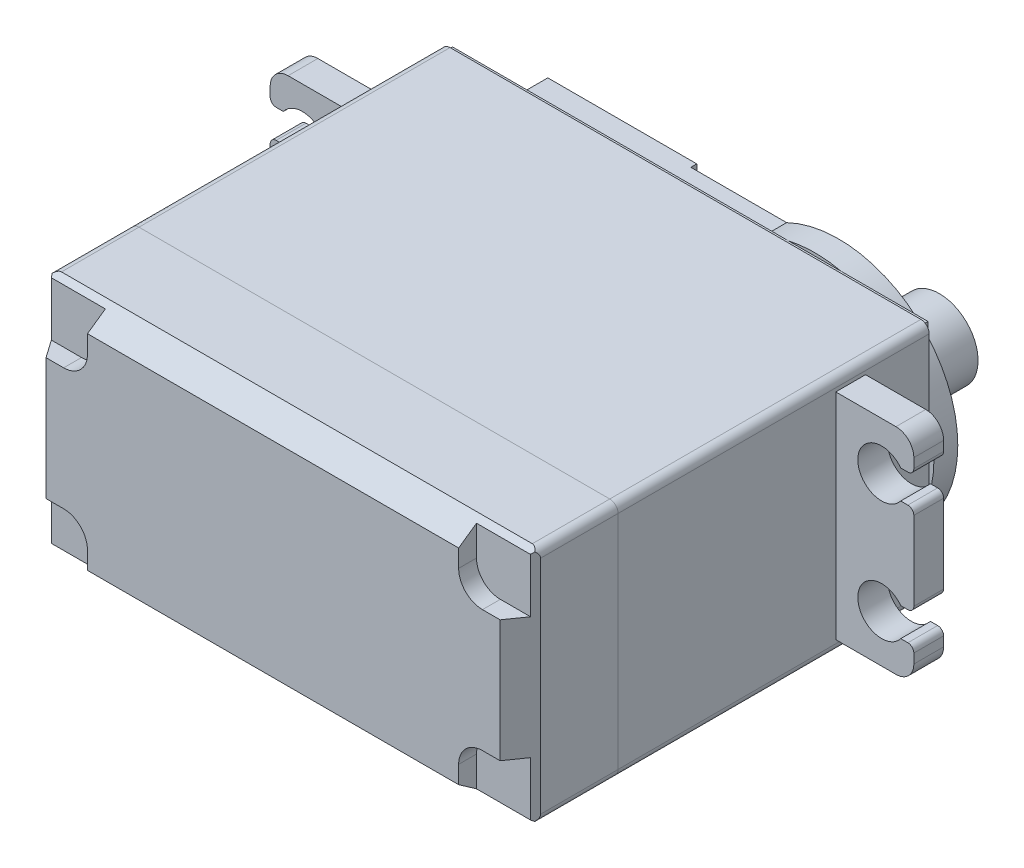
from build123d import *
from OCP.BRepFilletAPI import BRepFilletAPI_MakeChamfer

# Parameters (mm, degrees)
SKETCH1_W            = 40.9
SKETCH1_H            = 20
BOSS_EXTRUDE1_DEPTH  = 19.3
SKETCH2_W            = 40.9
SKETCH2_H            = 20
BOSS_EXTRUDE2_DEPTH  = 6.8
SKETCH3_W            = 40.9
SKETCH3_H            = 20
BOSS_EXTRUDE3_DEPTH  = 8.5
CHAMFER1_SIZE        = 2
CHAMFER1_SIZE2       = 1.400415076
CUT_EXTRUDE1_DEPTH   = 1.5
SKETCH5_W            = 39.9
SKETCH5_H            = 19.5
BOSS_EXTRUDE4_DEPTH  = 0.4
BOSS_EXTRUDE5_DEPTH  = 2
SKETCH8_R            = 6.5
BOSS_EXTRUDE6_DEPTH  = 1.5
SKETCH9_R            = 5.5
BOSS_EXTRUDE7_DEPTH  = 0.5
SKETCH10_R           = 3.25
BOSS_EXTRUDE8_DEPTH  = 5
SKETCH11_W           = 10.5
SKETCH11_H           = 15.998933302
BOSS_EXTRUDE9_DEPTH  = 0.5
FILLET1_R            = 0.7
FILLET2_R            = 0.7
FILLET3_R            = 0.7
BOSS_EXTRUDE10_START = -5.74
BOSS_EXTRUDE10_DEPTH = 2.5


with BuildPart() as part:
    # Sketch1 → Boss-Extrude1 (new body)
    with BuildSketch(Plane.XY):
        Rectangle(SKETCH1_W, SKETCH1_H)
    extrude(amount=BOSS_EXTRUDE1_DEPTH)

    # Fillet1
    fillet1_edges = [part.edges().sort_by_distance(p)[0] for p in [
        (-20.45, 10, 9.65),
        (20.45, 10, 9.65),
        (20.45, -10, 9.65),
        (-20.45, -10, 9.65),
    ]]
    fillet(fillet1_edges, radius=FILLET1_R)



with BuildPart() as body_2:
    # Sketch2 → Boss-Extrude2 (new body)
    with BuildSketch(Plane(origin=(0, 0, 0), x_dir=(-1, 0, 0), z_dir=(0, 0, -1))):
        Rectangle(SKETCH2_W, SKETCH2_H)
    extrude(amount=BOSS_EXTRUDE2_DEPTH)

    # Sketch5 → Boss-Extrude4 (add)
    with BuildSketch(Plane(origin=(0, 0, -6.8), x_dir=(-1, 0, 0), z_dir=(0, 0, -1))):
        Rectangle(SKETCH5_W, SKETCH5_H)
    extrude(amount=BOSS_EXTRUDE4_DEPTH)

    # Sketch7 → Boss-Extrude5 (add)
    with BuildSketch(Plane(origin=(0, 0, -7.2), x_dir=(-1, 0, 0), z_dir=(0, 0, -1))):
        with BuildLine():
            Line((-6.09, 8.999466651), (14.45, 8.999466651))
            Line((14.45, 8.999466651), (14.45, 3.918790103))
            ThreePointArc((14.45, 3.918790103), (17.45, 0), (14.45, -3.918790103))
            Line((14.45, -3.918790103), (14.45, -8.999466651))
            Line((14.45, -8.999466651), (-6.09, -8.999466651))
            ThreePointArc((-6.09, -8.999466651), (-20.45, 0), (-6.09, 8.999466651))
        make_face()
    extrude(amount=BOSS_EXTRUDE5_DEPTH)

    # Sketch8 → Boss-Extrude6 (add)
    with BuildSketch(Plane(origin=(0, 0, -9.2), x_dir=(-1, 0, 0), z_dir=(0, 0, -1))):
        with Locations((-11.900165179, 0)):
            Circle(SKETCH8_R)
    extrude(amount=BOSS_EXTRUDE6_DEPTH)

    # Sketch9 → Boss-Extrude7 (add)
    with BuildSketch(Plane(origin=(0, 0, -10.7), x_dir=(-1, 0, 0), z_dir=(0, 0, -1))):
        with Locations((-11.900165179, 0)):
            Circle(SKETCH9_R)
    extrude(amount=BOSS_EXTRUDE7_DEPTH)

    # Sketch10 → Boss-Extrude8 (add)
    with BuildSketch(Plane(origin=(0, 0, -11.2), x_dir=(-1, 0, 0), z_dir=(0, 0, -1))):
        with Locations((-11.900165179, 0)):
            Circle(SKETCH10_R)
    extrude(amount=BOSS_EXTRUDE8_DEPTH)

    # Sketch11 → Boss-Extrude9 (add)
    with BuildSketch(Plane(origin=(0, 0, -9.2), x_dir=(-1, 0, 0), z_dir=(0, 0, -1))):
        with BuildLine():
            Line((14.45, 8.999466651), (1.95, 8.999466651))
            Line((1.95, 8.999466651), (1.95, 1.75))
            ThreePointArc((1.95, 1.75), (0.2, 0), (1.95, -1.75))
            Line((1.95, -1.75), (1.95, -8.999466651))
            Line((1.95, -8.999466651), (14.45, -8.999466651))
            Line((14.45, -8.999466651), (14.45, 8.999466651))
        make_face()
        with Locations((8.2, 0)):
            Rectangle(SKETCH11_W, SKETCH11_H, mode=Mode.SUBTRACT)
    extrude(amount=BOSS_EXTRUDE9_DEPTH)

    # Fillet2
    fillet2_edges = [body_2.edges().sort_by_distance(p)[0] for p in [
        (20.45, -10, -3.4),
        (20.45, 10, -3.4),
        (-20.45, 10, -3.4),
        (-20.45, -10, -3.4),
    ]]
    fillet(fillet2_edges, radius=FILLET2_R)


with BuildPart() as body_3:
    # Sketch3 → Boss-Extrude3 (new body)
    with BuildSketch(Plane.XY.offset(19.3)):
        Rectangle(SKETCH3_W, SKETCH3_H)
    extrude(amount=BOSS_EXTRUDE3_DEPTH)

    # Chamfer1: one chamfer whose edges measure the first distance from different faces: ONE call of the kernel's chamfer builder (chamfer() names one face for all edges)
    chamfer1_edges_1 = [body_3.edges().sort_by_distance(p)[0] for p in [
        (0, -10, 27.8),
    ]]
    chamfer1_side_1 = [body_3.faces().sort_by_distance(p)[0] for p in [
        (0, -10, 23.55),
    ]]
    chamfer1_edges_2 = [body_3.edges().sort_by_distance(p)[0] for p in [
        (20.45, 0, 27.8),
    ]]
    chamfer1_side_2 = [body_3.faces().sort_by_distance(p)[0] for p in [
        (20.45, 0, 23.55),
    ]]
    chamfer1_edges_3 = [body_3.edges().sort_by_distance(p)[0] for p in [
        (0, 10, 27.8),
    ]]
    chamfer1_side_3 = [body_3.faces().sort_by_distance(p)[0] for p in [
        (0, 10, 23.55),
    ]]
    chamfer1_edges_4 = [body_3.edges().sort_by_distance(p)[0] for p in [
        (-20.45, 0, 27.8),
    ]]
    chamfer1_side_4 = [body_3.faces().sort_by_distance(p)[0] for p in [
        (-20.45, 0, 23.55),
    ]]
    chamfer1 = BRepFilletAPI_MakeChamfer(body_3.part.solid().wrapped)
    for e in chamfer1_edges_1:
        chamfer1.Add(CHAMFER1_SIZE, CHAMFER1_SIZE2, e.wrapped, chamfer1_side_1[0].wrapped)  # the first distance lies on this face
    for e in chamfer1_edges_2:
        chamfer1.Add(CHAMFER1_SIZE, CHAMFER1_SIZE2, e.wrapped, chamfer1_side_2[0].wrapped)  # the first distance lies on this face
    for e in chamfer1_edges_3:
        chamfer1.Add(CHAMFER1_SIZE, CHAMFER1_SIZE2, e.wrapped, chamfer1_side_3[0].wrapped)  # the first distance lies on this face
    for e in chamfer1_edges_4:
        chamfer1.Add(CHAMFER1_SIZE, CHAMFER1_SIZE2, e.wrapped, chamfer1_side_4[0].wrapped)  # the first distance lies on this face
    add(Compound.cast(chamfer1.Shape()), mode=Mode.REPLACE)

    # Sketch4 → Cut-Extrude1 (cut)
    with BuildSketch(Plane.XY.offset(27.8)):
        with BuildLine():
            Line((-20.45, 10), (-15.57, 10))
            Line((-15.57, 10), (-15.57, 7.12))
            ThreePointArc((-15.57, 7.12), (-16.155786438, 5.705786438), (-17.57, 5.12))
            Line((-17.57, 5.12), (-20.45, 5.12))
            Line((-20.45, 5.12), (-20.45, 10))
        make_face()
        with BuildLine():
            Line((15.57, 10), (15.57, 7.12))
            ThreePointArc((15.57, 7.12), (16.155786438, 5.705786438), (17.57, 5.12))
            Line((17.57, 5.12), (20.45, 5.12))
            Line((20.45, 5.12), (20.45, 10))
            Line((20.45, 10), (15.57, 10))
        make_face()
        with BuildLine():
            Line((-15.57, -10), (-15.57, -7.12))
            ThreePointArc((-15.57, -7.12), (-16.155786438, -5.705786438), (-17.57, -5.12))
            Line((-17.57, -5.12), (-20.45, -5.12))
            Line((-20.45, -5.12), (-20.45, -10))
            Line((-20.45, -10), (-15.57, -10))
        make_face()
        with BuildLine():
            Line((20.45, -10), (15.57, -10))
            Line((15.57, -10), (15.57, -7.12))
            ThreePointArc((15.57, -7.12), (16.155786438, -5.705786438), (17.57, -5.12))
            Line((17.57, -5.12), (20.45, -5.12))
            Line((20.45, -5.12), (20.45, -10))
        make_face()
    extrude(amount=-CUT_EXTRUDE1_DEPTH, mode=Mode.SUBTRACT)

    # Fillet3
    fillet3_edges = [body_3.edges().sort_by_distance(p)[0] for p in [
        (20.45, 10, 22.55),
        (20.45, -10, 22.55),
        (-20.45, -10, 22.55),
        (-20.45, 10, 22.55),
    ]]
    fillet(fillet3_edges, radius=FILLET3_R)


with BuildPart() as part_1:
    add(part.part)

    add(body_2.part)  # Boss-Extrude10 merges body 2
    # Sketch12 → Boss-Extrude10 (add)
    with BuildSketch(Plane(origin=(0, 0, -7.2), x_dir=(-1, 0, 0), z_dir=(0, 0, -1)).offset(BOSS_EXTRUDE10_START)):
        with BuildLine():
            Line((20.45, 9), (25.5, 9))
            ThreePointArc((25.5, 9), (26.560660172, 8.560660172), (27, 7.5))
            Line((27, 7.5), (27, 6.7))
            ThreePointArc((27, 6.7), (26.853553391, 6.346446609), (26.5, 6.2))
            Line((26.5, 6.2), (25.9, 6.2))
            ThreePointArc((25.9, 6.2), (22.3, 5), (25.9, 3.8))
            Line((25.9, 3.8), (26.5, 3.8))
            ThreePointArc((26.5, 3.8), (26.853553391, 3.653553391), (27, 3.3))
            Line((27, 3.3), (27, -3.3))
            ThreePointArc((27, -3.3), (26.853553391, -3.653553391), (26.5, -3.8))
            Line((26.5, -3.8), (25.9, -3.8))
            ThreePointArc((25.9, -3.8), (22.3, -5), (25.9, -6.2))
            Line((25.9, -6.2), (26.5, -6.2))
            ThreePointArc((26.5, -6.2), (26.853553391, -6.346446609), (27, -6.7))
            Line((27, -6.7), (27, -7.5))
            ThreePointArc((27, -7.5), (26.560660172, -8.560660172), (25.5, -9))
            Line((25.5, -9), (20.45, -9))
            Line((20.45, -9), (20.45, 9))
        make_face()
    boss_extrude10 = extrude(amount=-BOSS_EXTRUDE10_DEPTH)

    # Mirror1: Boss-Extrude10 across plane
    add(boss_extrude10.mirror(Plane(origin=(0, 0, 0), x_dir=(0, 0, 1), z_dir=(1, 0, 0))))


solid = Compound([body_3.part, part_1.part])
